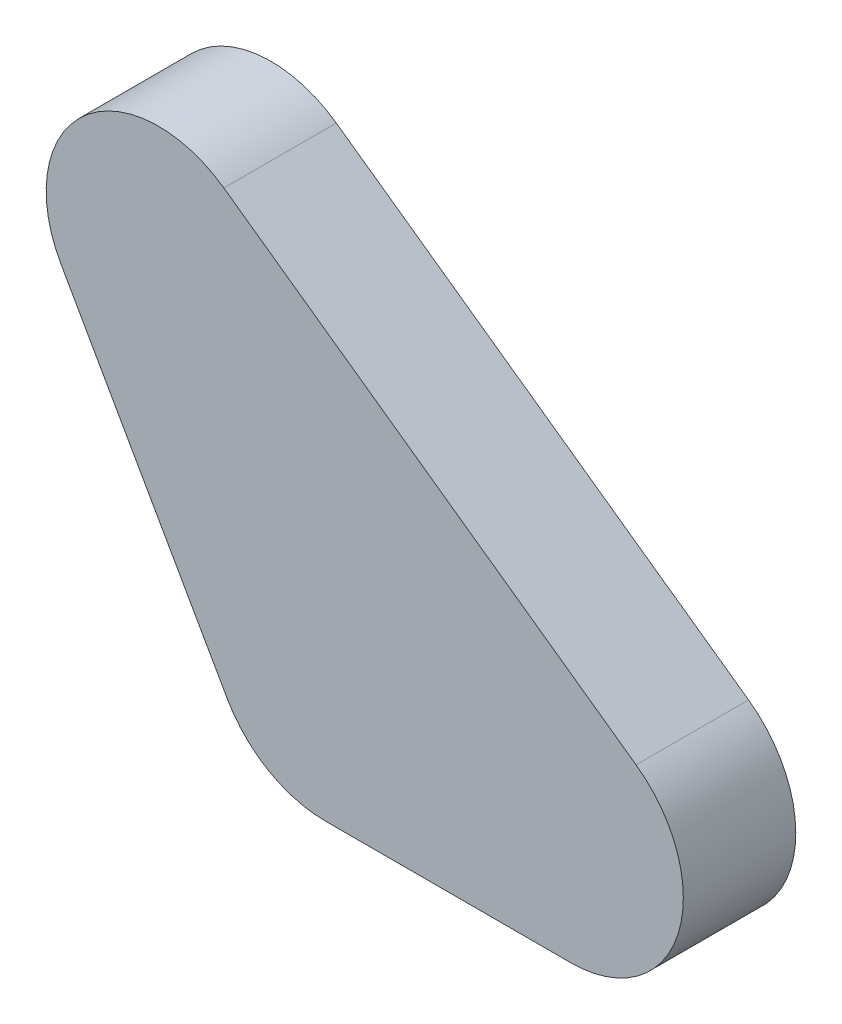
from build123d import *

# Parameters (mm, degrees)
EXTRUDE_1_DEPTH = 10


with BuildPart() as part:
    # 草图1 → 凸台-拉伸1 (new body)
    with BuildSketch(Plane.XY):
        with BuildLine():
            Line((14.797735357, -36.09649456), (36.660236929, -36.09649456))
            ThreePointArc((36.660236929, -36.09649456), (46.185655376, -29.140571335), (42.459457942, -17.949775242))
            Line((42.459457942, -17.949775242), (5.799221013, 8.146719318))
            ThreePointArc((5.799221013, 8.146719318), (-6.698428384, 7.425029104), (-8.69883152, -4.932578452))
            Line((-8.69883152, -4.932578452), (6.098903837, -31.029073012))
            ThreePointArc((6.098903837, -31.029073012), (9.764137464, -34.737263754), (14.797735357, -36.09649456))
        make_face()
    extrude(amount=EXTRUDE_1_DEPTH)


solid = part.part
